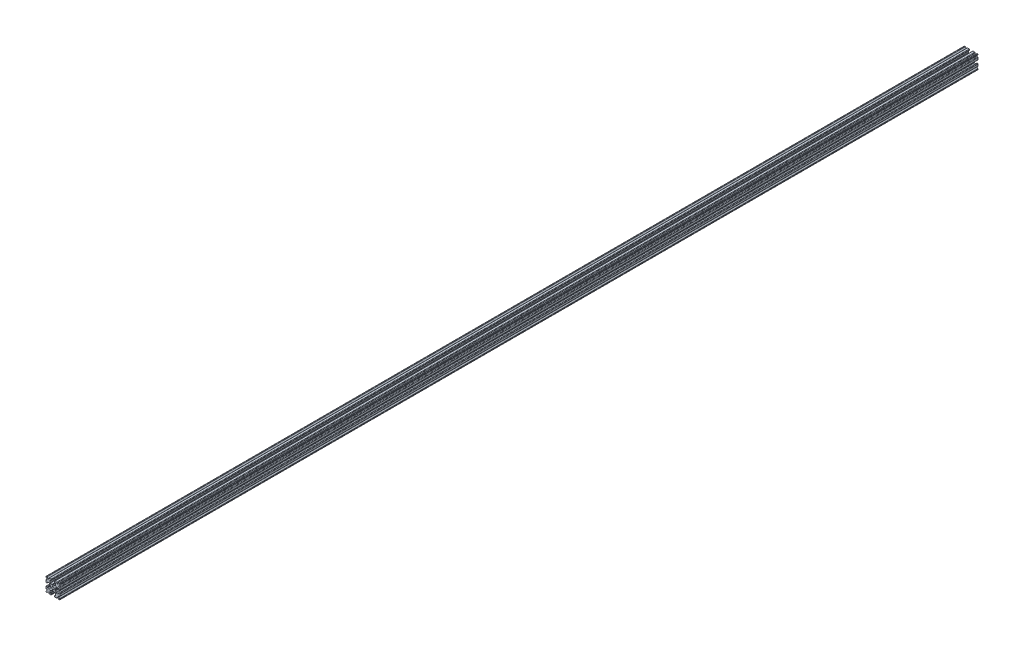
from build123d import *

# Parameters (mm, degrees)
SKETCH1_W           = 15
SKETCH1_H           = 15
SKETCH1_R           = 1.25
BOSS_EXTRUDE1_DEPTH = 500
FILLET1_R           = 0.25
CUT_EXTRUDE1_DEPTH  = 1001.056248418
CUT_EXTRUDE3_DEPTH  = 1001.056248418
FILLET3_R           = 0.5
FILLET4_R           = 0.5
FILLET5_R           = 3
FILLET6_R           = 0.2
CUT_EXTRUDE4_DEPTH  = 1001.056248418
FILLET8_R           = 0.5
SKETCH6_W           = 5.1529354
SKETCH6_H           = 1.651
SKETCH6_W_2         = 1.651
SKETCH6_H_2         = 5.1529354
CUT_EXTRUDE5_DEPTH  = 1001.056248418
FILLET10_R          = 0.2


with BuildPart() as part:
    # Sketch1 → Boss-Extrude1 (new, symmetric)
    with BuildSketch(Plane.XY):
        Rectangle(SKETCH1_W, SKETCH1_H)
        Circle(SKETCH1_R, mode=Mode.SUBTRACT)
    extrude(amount=BOSS_EXTRUDE1_DEPTH, both=True)

    # Fillet1
    fillet1_edges = [part.edges().sort_by_distance(p)[0] for p in [
        (7.5, -7.5, 0),
        (-7.5, -7.5, 0),
        (-7.5, 7.5, 0),
        (7.5, 7.5, 0),
    ]]
    fillet(fillet1_edges, radius=FILLET1_R)

    # Sketch2 → Cut-Extrude1 (cut, through all)
    with BuildSketch(Plane.XY.offset(500)):
        Polygon((-7.5, 1.6), (-6.1, 1.6), (-6.1, 2.9), (-3.4, 2.9), (-3.4, -2.9), (-6.1, -2.9), (-6.1, -1.6), (-7.5, -1.6), align=None)
        Polygon((2.9, 6.1), (1.6, 6.1), (1.6, 7.5), (-1.6, 7.5), (-1.6, 6.1), (-2.9, 6.1), (-2.9, 3.4), (2.9, 3.4), align=None)
        Polygon((-1.6, -7.5), (-1.6, -6.1), (-2.9, -6.1), (-2.9, -3.4), (2.9, -3.4), (2.9, -6.1), (1.6, -6.1), (1.6, -7.5), align=None)
        Polygon((6.1, -2.9), (6.1, -1.6), (7.5, -1.6), (7.5, 1.6), (6.1, 1.6), (6.1, 2.9), (3.4, 2.9), (3.4, -2.9), align=None)
    extrude(amount=-CUT_EXTRUDE1_DEPTH, mode=Mode.SUBTRACT)

    # Sketch4 → Cut-Extrude3 (cut, through all)
    with BuildSketch(Plane.XY.offset(500)):
        Polygon((-3.4, 2.9), (-2.75, 0), (-3.4, -2.9), align=None)
        Polygon((-2.9, 3.4), (0, 2.75), (2.9, 3.4), align=None)
        Polygon((3.4, 2.9), (2.75, 0), (3.4, -2.9), align=None)
        Polygon((-2.9, -3.4), (0, -2.75), (2.9, -3.4), align=None)
    extrude(amount=-CUT_EXTRUDE3_DEPTH, mode=Mode.SUBTRACT)

    # Fillet3
    fillet3_edges = [part.edges().sort_by_distance(p)[0] for p in [
        (1.6, -7.5, 0),
        (-1.6, -7.5, 0),
        (-1.6, -6.1, 0),
        (1.6, -6.1, 0),
        (6.1, 1.6, 0),
        (7.5, 1.6, 0),
        (7.5, -1.6, 0),
        (6.1, -1.6, 0),
        (-7.5, -1.6, 0),
        (-7.5, 1.6, 0),
        (-6.1, 1.6, 0),
        (-6.1, -1.6, 0),
        (-1.6, 6.1, 0),
        (-1.6, 7.5, 0),
        (1.6, 7.5, 0),
        (1.6, 6.1, 0),
    ]]
    fillet(fillet3_edges, radius=FILLET3_R)

    # Fillet4
    fillet4_edges = [part.edges().sort_by_distance(p)[0] for p in [
        (-2.9, -3.4, 0),
        (2.9, -3.4, 0),
        (3.4, -2.9, 0),
        (3.4, 2.9, 0),
        (-3.4, 2.9, 0),
        (-3.4, -2.9, 0),
        (2.9, 3.4, 0),
        (-2.9, 3.4, 0),
    ]]
    fillet(fillet4_edges, radius=FILLET4_R)

    # Fillet5
    fillet5_edges = [part.edges().sort_by_distance(p)[0] for p in [
        (-2.75, 0, 0),
        (0, 2.75, 0),
        (2.75, 0, 0),
        (0, -2.75, 0),
    ]]
    fillet(fillet5_edges, radius=FILLET5_R)

    # Fillet6
    fillet6_edges = [part.edges().sort_by_distance(p)[0] for p in [
        (-2.9, -6.1, 0),
        (2.9, -6.1, 0),
        (6.1, -2.9, 0),
        (6.1, 2.9, 0),
        (-6.1, 2.9, 0),
        (-6.1, -2.9, 0),
        (2.9, 6.1, 0),
        (-2.9, 6.1, 0),
    ]]
    fillet(fillet6_edges, radius=FILLET6_R)

    # Sketch5 → Cut-Extrude4 (cut, through all)
    with BuildSketch(Plane.XY.offset(500)):
        Polygon((-7.5, 6.439339828), (-5.460660172, 4.4), (-7.5, 4.4), align=None)
        Polygon((-6.439339828, 7.5), (-4.4, 5.460660172), (-4.4, 7.5), align=None)
        Polygon((4.4, 7.5), (6.439339828, 7.5), (4.4, 5.460660172), align=None)
        Polygon((7.5, 6.439339828), (7.5, 4.4), (5.460660172, 4.4), align=None)
        Polygon((7.5, -6.439339828), (5.460660172, -4.4), (7.5, -4.4), align=None)
        Polygon((6.439339828, -7.5), (4.4, -5.460660172), (4.4, -7.5), align=None)
        Polygon((-4.4, -7.5), (-6.439339828, -7.5), (-4.4, -5.460660172), align=None)
        Polygon((-7.5, -6.439339828), (-7.5, -4.4), (-5.460660172, -4.4), align=None)
    extrude(amount=-CUT_EXTRUDE4_DEPTH, mode=Mode.SUBTRACT)

    # Fillet8
    fillet8_edges = [part.edges().sort_by_distance(p)[0] for p in [
        (-7.5, 4.4, 0),
        (-7.5, 6.439339828, 0),
        (-5.460660172, 4.4, 0),
        (7.5, -4.4, 0),
        (7.5, -6.439339828, 0),
        (5.460660172, -4.4, 0),
        (5.460660172, 4.4, 0),
        (7.5, 6.439339828, 0),
        (7.5, 4.4, 0),
        (-4.4, 7.5, 0),
        (-4.4, 5.460660172, 0),
        (-6.439339828, 7.5, 0),
        (-5.460660172, -4.4, 0),
        (-7.5, -6.439339828, 0),
        (-7.5, -4.4, 0),
        (4.4, 5.460660172, 0),
        (4.4, 7.5, 0),
        (6.439339828, 7.5, 0),
        (6.439339828, -7.5, 0),
        (4.4, -7.5, 0),
        (4.4, -5.460660172, 0),
        (-6.439339828, -7.5, 0),
        (-4.4, -5.460660172, 0),
        (-4.4, -7.5, 0),
    ]]
    fillet(fillet8_edges, radius=FILLET8_R)

    # Sketch6 → Cut-Extrude5 (cut, through all)
    with BuildSketch(Plane.XY.offset(500)):
        with Locations((4.9235323, 0)):
            Rectangle(SKETCH6_W, SKETCH6_H)
        with Locations((0, -4.9235323)):
            Rectangle(SKETCH6_W_2, SKETCH6_H_2)
        with Locations((-4.9235323, 0)):
            Rectangle(SKETCH6_W, SKETCH6_H)
        with Locations((0, 4.9235323)):
            Rectangle(SKETCH6_W_2, SKETCH6_H_2)
    extrude(amount=-CUT_EXTRUDE5_DEPTH, mode=Mode.SUBTRACT)

    # Fillet10
    fillet10_edges = [part.edges().sort_by_distance(p)[0] for p in [
        (0.8255, -2.935025862, 0),
        (-0.8255, -2.935025862, 0),
        (0.8255, -2.3470646, 0),
        (-0.8255, -2.3470646, 0),
        (2.935025862, 0.8255, 0),
        (2.935025862, -0.8255, 0),
        (2.3470646, 0.8255, 0),
        (2.3470646, -0.8255, 0),
        (-2.935025862, -0.8255, 0),
        (-2.935025862, 0.8255, 0),
        (-2.3470646, -0.8255, 0),
        (-2.3470646, 0.8255, 0),
        (-0.8255, 2.935025862, 0),
        (0.8255, 2.935025862, 0),
        (-0.8255, 2.3470646, 0),
        (0.8255, 2.3470646, 0),
    ]]
    fillet(fillet10_edges, radius=FILLET10_R)


solid = part.part
